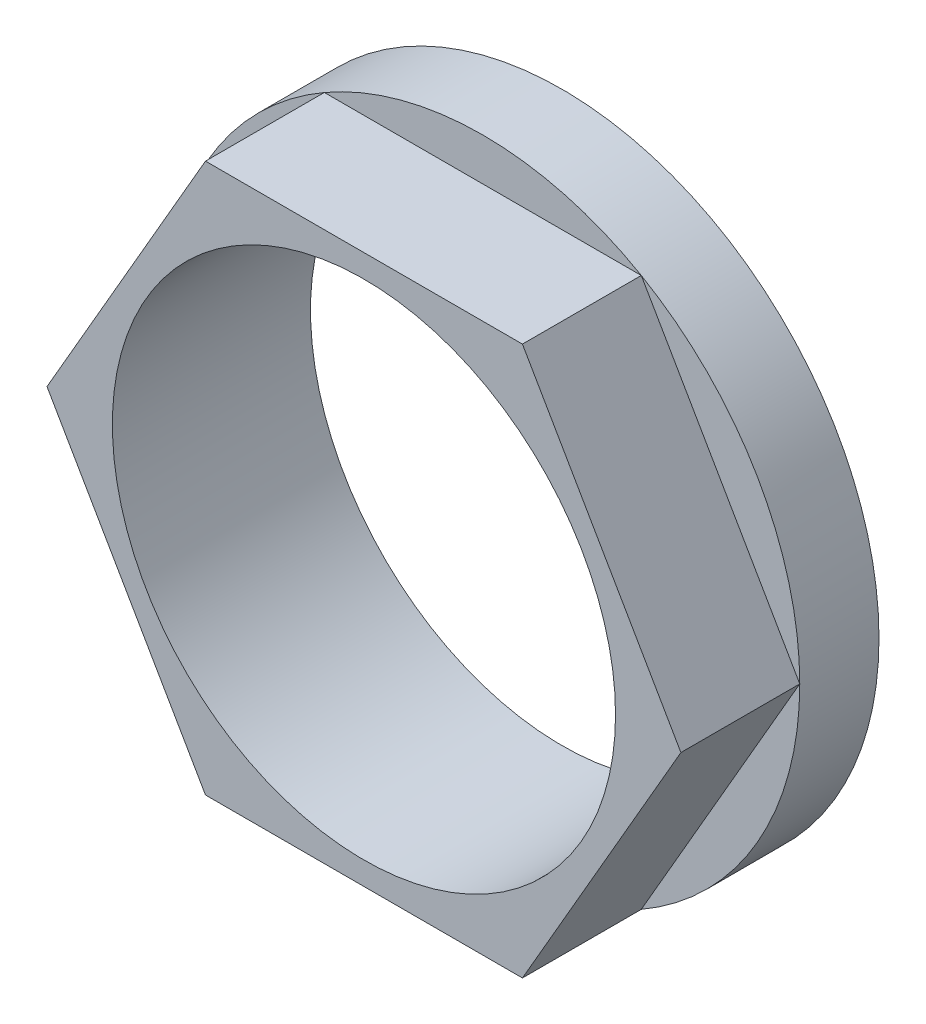
from build123d import *

# Parameters (mm, degrees)
ESQUISSE1_R        = 8
ESQUISSE1_R_2      = 6.35
BOSS_EXTRU_1_DEPTH = 2
ESQUISSE2_R        = 6.35
BOSS_EXTRU_2_DEPTH = 3


with BuildPart() as part:
    # Esquisse1 → Boss.-Extru.1 (new body)
    with BuildSketch(Plane.XY):
        Circle(ESQUISSE1_R)
        Circle(ESQUISSE1_R_2, mode=Mode.SUBTRACT)
    extrude(amount=BOSS_EXTRU_1_DEPTH)

    # Esquisse2 → Boss.-Extru.2 (add)
    with BuildSketch(Plane.XY.offset(2)):
        Polygon((8, 0), (4, 6.92820323), (-4, 6.92820323), (-8, 0), (-4, -6.92820323), (4, -6.92820323), align=None)
        Circle(ESQUISSE2_R, mode=Mode.SUBTRACT)
    extrude(amount=BOSS_EXTRU_2_DEPTH)


solid = part.part
